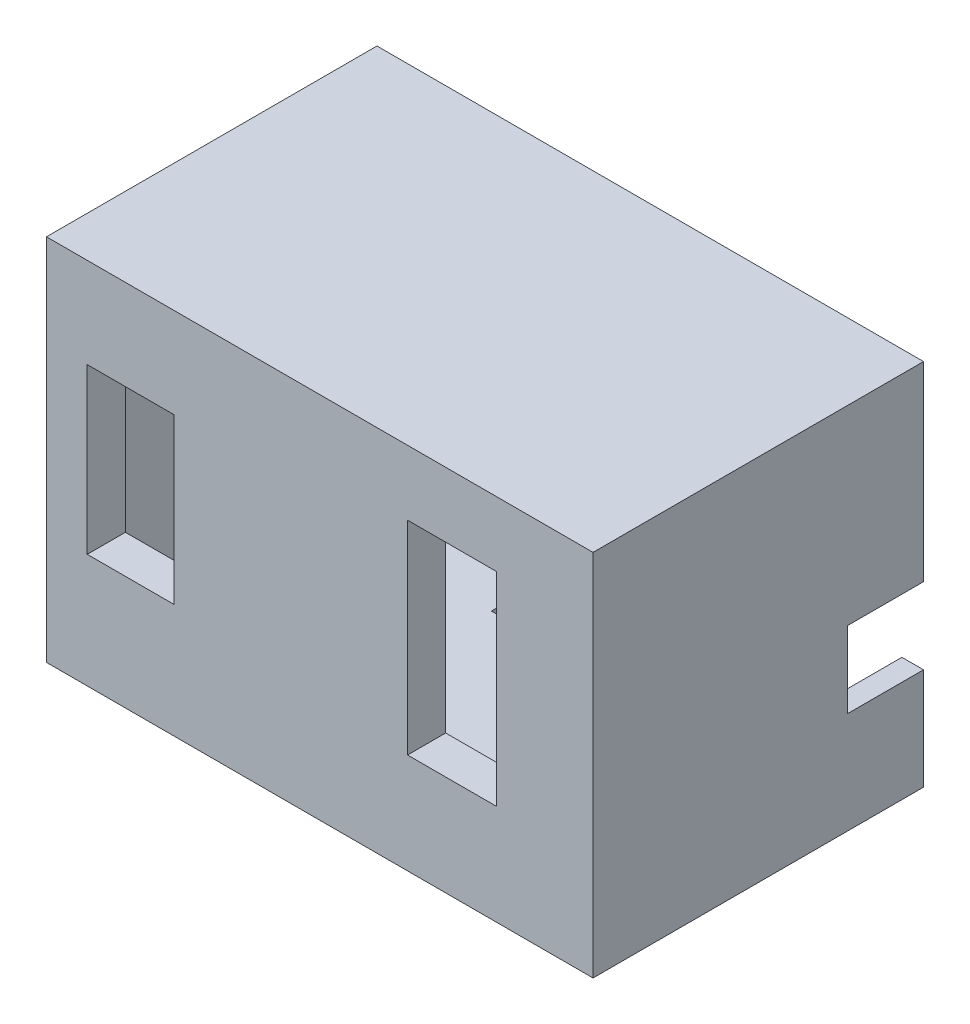
from build123d import *

# Parameters (mm, degrees)
SKETCH1_W           = 215
SKETCH1_H           = 145
BOSS_EXTRUDE1_DEPTH = 130
SKETCH3_W           = 30
SKETCH3_H           = 30
CUT_EXTRUDE1_DEPTH  = 262.498087947
SKETCH4_W           = 198
SKETCH4_H           = 125
CUT_EXTRUDE2_DEPTH  = 115
SKETCH5_W           = 34.065007978
SKETCH5_H           = 64.63018637
CUT_EXTRUDE3_DEPTH  = 115
SKETCH6_W           = 35
SKETCH6_H           = 80
CUT_EXTRUDE4_DEPTH  = 115
SKETCH7_W           = 60
SKETCH7_H           = 35
CUT_EXTRUDE5_DEPTH  = 115


with BuildPart() as part:
    # Sketch1 → Boss-Extrude1 (new body)
    with BuildSketch(Plane.XY):
        Rectangle(SKETCH1_W, SKETCH1_H)
    extrude(amount=BOSS_EXTRUDE1_DEPTH)

    # Sketch3 → Cut-Extrude1 (cut, through all)
    with BuildSketch(Plane.ZY.offset(107.5)):
        with Locations((15, -17.5)):
            Rectangle(SKETCH3_W, SKETCH3_H)
    extrude(amount=-CUT_EXTRUDE1_DEPTH, mode=Mode.SUBTRACT)

    # Sketch4 → Cut-Extrude2 (cut)
    with BuildSketch(Plane(origin=(0, 0, 0), x_dir=(-1, 0, 0), z_dir=(0, 0, -1))):
        Rectangle(SKETCH4_W, SKETCH4_H)
    extrude(amount=-CUT_EXTRUDE2_DEPTH, mode=Mode.SUBTRACT)

    # Sketch5 → Cut-Extrude3 (cut)
    with BuildSketch(Plane.XY.offset(130)):
        with Locations((-74.429709212, 4.666439449)):
            Rectangle(SKETCH5_W, SKETCH5_H)
    extrude(amount=-CUT_EXTRUDE3_DEPTH, mode=Mode.SUBTRACT)

    # Sketch6 → Cut-Extrude4 (cut)
    with BuildSketch(Plane.XY.offset(130)):
        with Locations((52.031651923, 6.984940898)):
            Rectangle(SKETCH6_W, SKETCH6_H)
    extrude(amount=-CUT_EXTRUDE4_DEPTH, mode=Mode.SUBTRACT)

    # Sketch7 → Cut-Extrude5 (cut)
    with BuildSketch(Plane.XZ.offset(72.5)):
        with Locations((2.5, 17.5)):
            Rectangle(SKETCH7_W, SKETCH7_H)
    extrude(amount=-CUT_EXTRUDE5_DEPTH, mode=Mode.SUBTRACT)


solid = part.part
